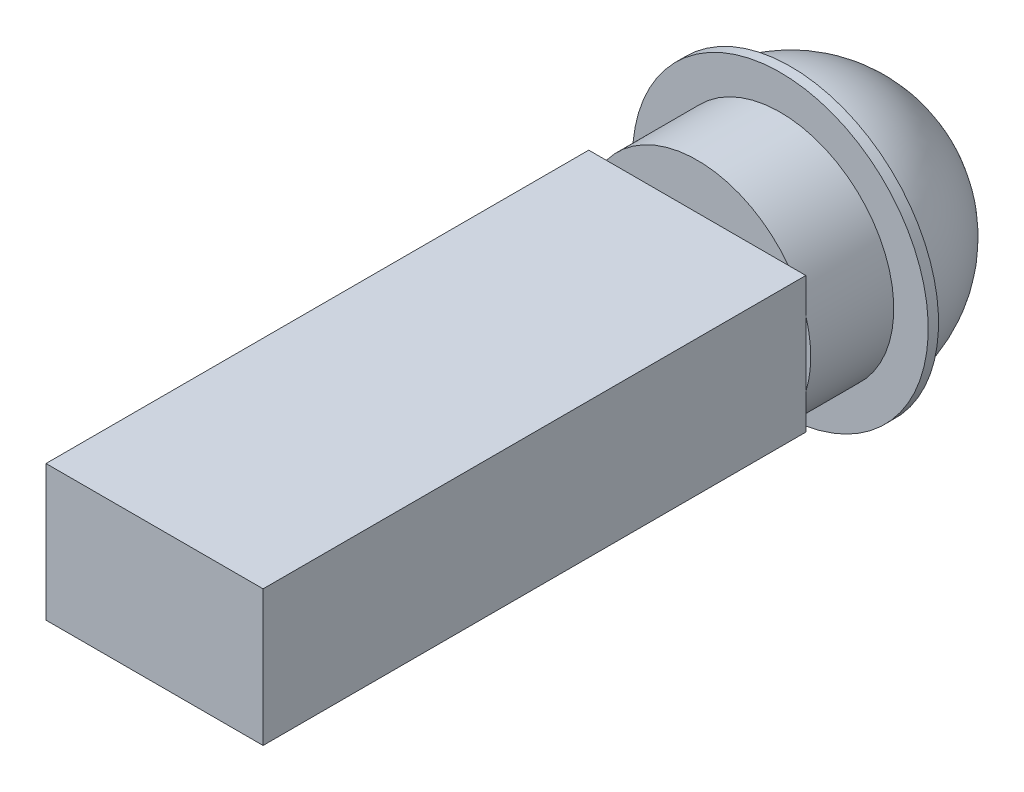
from build123d import *

# Parameters (mm, degrees)
SKETCH2_W           = 10.16
SKETCH2_H           = 6.35
BOSS_EXTRUDE1_DEPTH = 25.4


with BuildPart() as part:
    # Sketch1 → Revolve1 (revolve)
    with BuildSketch(Plane(origin=(0, 0, 0), x_dir=(1, 0, 0), z_dir=(0, 1, 0))):
        with BuildLine():
            Line((0, 6.20395), (0, -4.3688))
            Line((0, -4.3688), (-5.3086, -4.3688))
            Line((-5.3086, -4.3688), (-5.3086, -0.4826))
            Line((-5.3086, -0.4826), (-6.9215, -0.4826))
            Line((-6.9215, -0.4826), (-6.9215, 0))
            Line((-6.9215, 0), (-6.20395, 0))
            ThreePointArc((-6.20395, 0), (-4.386855115, 4.386855115), (0, 6.20395))
        make_face()
    revolve(axis=Axis((0, 0, -6.20395), (0, 0, 1)))

    # Sketch2 → Boss-Extrude1 (add)
    with BuildSketch(Plane.XY.offset(4.3688)):
        Rectangle(SKETCH2_W, SKETCH2_H)
    extrude(amount=BOSS_EXTRUDE1_DEPTH)


solid = part.part
